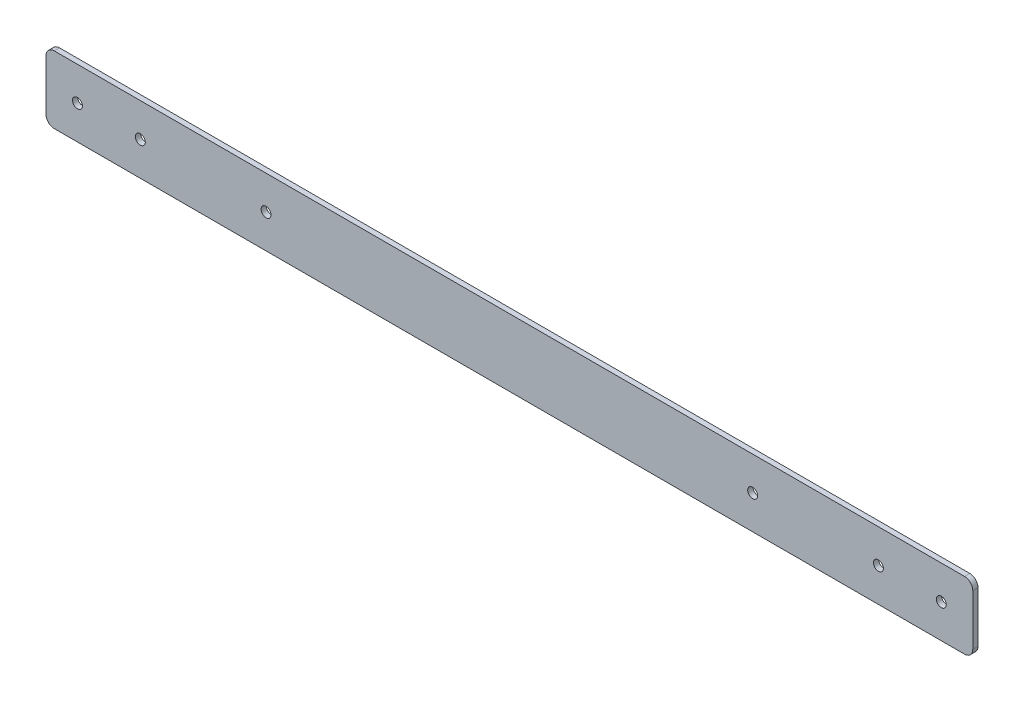
from build123d import *

# Parameters (mm, degrees)
SKETCH1_R           = 6
BOSS_EXTRUDE1_DEPTH = 6.35


with BuildPart() as part:
    # Sketch1 → Boss-Extrude1 (new body)
    with BuildSketch(Plane.XY):
        with BuildLine():
            Line((10, 0), (1113, 0))
            ThreePointArc((1113, 0), (1120.071067812, 2.928932188), (1123, 10))
            Line((1123, 10), (1123, 71.6))
            ThreePointArc((1123, 71.6), (1120.071067812, 78.671067812), (1113, 81.6))
            Line((1113, 81.6), (10, 81.6))
            ThreePointArc((10, 81.6), (2.928932188, 78.671067812), (0, 71.6))
            Line((0, 71.6), (0, 10))
            ThreePointArc((0, 10), (2.928932188, 2.928932188), (10, 0))
        make_face()
        with Locations((38.1, 40.8)):
            Circle(SKETCH1_R, mode=Mode.SUBTRACT)
        with Locations((114.3, 40.8)):
            Circle(SKETCH1_R, mode=Mode.SUBTRACT)
        with Locations((266.7, 40.8)):
            Circle(SKETCH1_R, mode=Mode.SUBTRACT)
        with Locations(Location((856.3, 40.8, 0), (0, 0, 180))):
            Circle(SKETCH1_R, mode=Mode.SUBTRACT)
        with Locations(Location((1008.7, 40.8, 0), (0, 0, 180))):
            Circle(SKETCH1_R, mode=Mode.SUBTRACT)
        with Locations(Location((1084.9, 40.8, 0), (0, 0, 180))):
            Circle(SKETCH1_R, mode=Mode.SUBTRACT)
    extrude(amount=BOSS_EXTRUDE1_DEPTH)


solid = part.part
